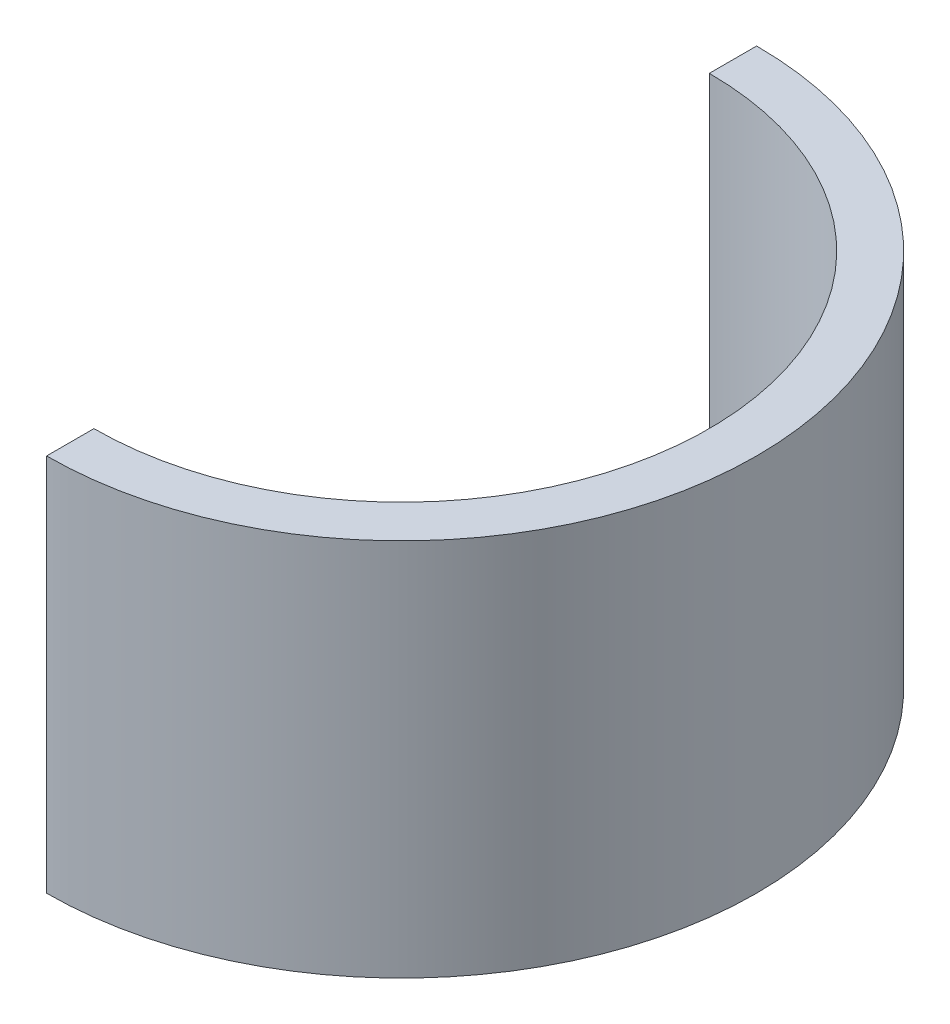
from build123d import *

# Parameters (mm, degrees)
BOSS_EXTRUDE1_DEPTH = 8


with BuildPart() as part:
    # Sketch1 → Boss-Extrude1 (new body)
    with BuildSketch(Plane(origin=(0, 0, 0), x_dir=(1, 0, 0), z_dir=(0, 1, 0))):
        with BuildLine():
            Line((0, 7.5), (0, 6.5))
            ThreePointArc((0, 6.5), (6.5, 0), (0, -6.5))
            Line((0, -6.5), (0, -7.5))
            ThreePointArc((0, -7.5), (7.5, 0), (0, 7.5))
        make_face()
    extrude(amount=BOSS_EXTRUDE1_DEPTH)


solid = part.part
